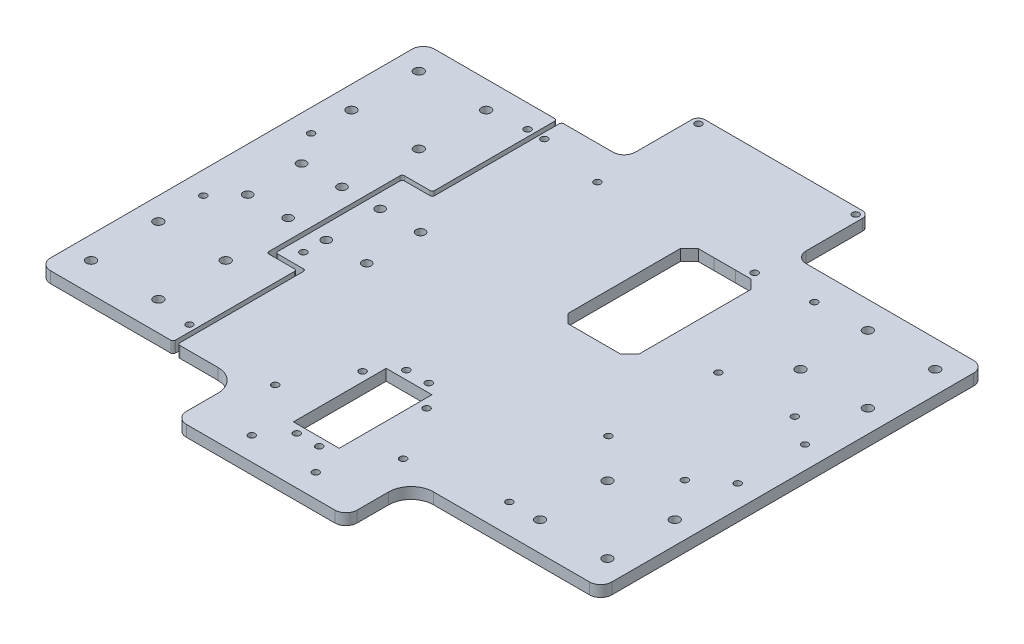
from build123d import *

# Parameters (mm, degrees)
SKETCH_1_W           = 250
SKETCH_1_H           = 200
EXTRUDE_1_DEPTH      = 5
SKETCH_2_W           = 62
SKETCH_2_H           = 29
SKETCH_2_W_2         = 60
CUT_EXTRUDE_1_DEPTH  = 161.15617378
SKETCH_12_R          = 2.1
CUT_EXTRUDE_11_DEPTH = 10
SKETCH_15_R          = 1.5
CUT_EXTRUDE_14_DEPTH = 15
SKETCH_16_W          = 24.445253359
SKETCH_16_H          = 29
SKETCH_16_W_2        = 27.468529174
CUT_EXTRUDE_15_DEPTH = 15
FILLET_1_R           = 10
SKETCH_20_W          = 76.086217467
SKETCH_20_H          = 5
EXTRUDE_3_DEPTH      = 33
FILLET_3_R           = 3
FILLET_4_R           = 5
SKETCH_25_W          = 20.382425605
SKETCH_25_H          = 41.31601021
CUT_EXTRUDE_19_DEPTH = 10
SKETCH_26_R          = 1.5
CUT_EXTRUDE_20_DEPTH = 10
CUT_EXTRUDE_22_DEPTH = 10
SKETCH_27_R          = 2
CUT_EXTRUDE_21_DEPTH = 10
FILLET_5_R           = 1
FILLET_6_R           = 1
SKETCH_29_R          = 1.5
CUT_EXTRUDE_23_DEPTH = 10
SKETCH_30_R          = 1.5
CUT_EXTRUDE_24_DEPTH = 10
SKETCH_32_R          = 1.5
CUT_EXTRUDE_27_DEPTH = 5
CUT_EXTRUDE_30_DEPTH = 5
SKETCH_39_R          = 1.5
CUT_EXTRUDE_31_DEPTH = 5


with BuildPart() as part:
    # 草图1 → 凸台-拉伸1 (new body)
    with BuildSketch(Plane(origin=(0, 0, 0), x_dir=(1, 0, 0), z_dir=(0, 1, 0))):
        Rectangle(SKETCH_1_W, SKETCH_1_H)
    extrude(amount=EXTRUDE_1_DEPTH)

    # 草图2 → 切除-拉伸1 (cut, through all)
    with BuildSketch(Plane(origin=(0, 5, 0), x_dir=(1, 0, 0), z_dir=(0, 1, 0))):
        with Locations((-94, -85.5)):
            Rectangle(SKETCH_2_W, SKETCH_2_H)
        with Locations((95, -85.5)):
            Rectangle(SKETCH_2_W_2, SKETCH_2_H)
    extrude(amount=-CUT_EXTRUDE_1_DEPTH, mode=Mode.SUBTRACT)

    # 草图12 → 切除-拉伸11 (cut)
    with BuildSketch(Plane(origin=(0, 5, 0), x_dir=(1, 0, 0), z_dir=(0, 1, 0))):
        with Locations(Location((85, -28, 0), (0, 0, 270))):
            Circle(SKETCH_12_R)
        with Locations(Location((115, -28, 0), (0, 0, 270))):
            Circle(SKETCH_12_R)
        with Locations(Location((115, -58, 0), (0, 0, 270))):
            Circle(SKETCH_12_R)
        with Locations(Location((85, -58, 0), (0, 0, 270))):
            Circle(SKETCH_12_R)
        with Locations(Location((-115, -28, 0), (0, 0, 270))):
            Circle(SKETCH_12_R)
        with Locations(Location((-85, -28, 0), (0, 0, 270))):
            Circle(SKETCH_12_R)
        with Locations(Location((-85, -58, 0), (0, 0, 270))):
            Circle(SKETCH_12_R)
        with Locations(Location((-115, -58, 0), (0, 0, 270))):
            Circle(SKETCH_12_R)
        with Locations(Location((-115, 88, 0), (0, 0, 270))):
            Circle(SKETCH_12_R)
        with Locations(Location((-85, 88, 0), (0, 0, 270))):
            Circle(SKETCH_12_R)
        with Locations(Location((-115, 58, 0), (0, 0, 270))):
            Circle(SKETCH_12_R)
        with Locations(Location((-85, 58, 0), (0, 0, 270))):
            Circle(SKETCH_12_R)
        with Locations(Location((115, 88, 0), (0, 0, 270))):
            Circle(SKETCH_12_R)
        with Locations(Location((85, 88, 0), (0, 0, 270))):
            Circle(SKETCH_12_R)
        with Locations(Location((115, 58, 0), (0, 0, 270))):
            Circle(SKETCH_12_R)
        with Locations(Location((85, 58, 0), (0, 0, 270))):
            Circle(SKETCH_12_R)
    extrude(amount=-CUT_EXTRUDE_11_DEPTH, mode=Mode.SUBTRACT)

    # 草图15 → 切除-拉伸14 (cut)
    with BuildSketch(Plane(origin=(0, 5, 0), x_dir=(1, 0, 0), z_dir=(0, 1, 0))):
        with Locations(Location((-115, 40, 0), (0, 0, 270))):
            Circle(SKETCH_15_R)
        with Locations(Location((-115, -8, 0), (0, 0, 270))):
            Circle(SKETCH_15_R)
        with Locations(Location((115, 0, 0), (0, 0, 270))):
            Circle(SKETCH_15_R)
        with Locations(Location((115, 30, 0), (0, 0, 270))):
            Circle(SKETCH_15_R)
        with Locations(Location((-68.353884334, -60.793566597, 0), (0, 0, 270))):
            Circle(SKETCH_15_R)
        with Locations(Location((-68.353884334, 89.793566597, 0), (0, 0, 270))):
            Circle(SKETCH_15_R)
        with Locations(Location((62.145255031, 87, 0), (0, 0, 270))):
            Circle(SKETCH_15_R)
        with Locations(Location((71.352890761, -58, 0), (0, 0, 270))):
            Circle(SKETCH_15_R)
    extrude(amount=-CUT_EXTRUDE_14_DEPTH, mode=Mode.SUBTRACT)

    # 草图16 → 切除-拉伸15 (cut)
    with BuildSketch(Plane(origin=(0, 5, 0), x_dir=(1, 0, 0), z_dir=(0, 1, 0))):
        with Locations((52.777373321, -85.5)):
            Rectangle(SKETCH_16_W, SKETCH_16_H)
        with Locations((-49.265735413, -85.5)):
            Rectangle(SKETCH_16_W_2, SKETCH_16_H)
    extrude(amount=-CUT_EXTRUDE_15_DEPTH, mode=Mode.SUBTRACT)

    # 圆角1
    fillet_1_edges = [part.edges().sort_by_distance(p)[0] for p in [
        (40.554746641, 2.5, 71),
        (-35.531470826, 2.5, 71),
    ]]
    fillet(fillet_1_edges, radius=FILLET_1_R)

    # 草图20 → 凸台-拉伸3 (add)
    with BuildSketch(Plane(origin=(0, 0, -100), x_dir=(-1, 0, 0), z_dir=(0, 0, -1))):
        with Locations((-2.511637907, 2.5)):
            Rectangle(SKETCH_20_W, SKETCH_20_H)
    extrude(amount=EXTRUDE_3_DEPTH)

    # 圆角3
    fillet_3_edges = [part.edges().sort_by_distance(p)[0] for p in [
        (40.554746641, 2.5, -133),
        (-35.531470826, 2.5, -133),
    ]]
    fillet(fillet_3_edges, radius=FILLET_3_R)

    # 圆角4
    fillet_4_edges = [part.edges().sort_by_distance(p)[0] for p in [
        (40.554746641, 2.5, 100),
        (-35.531470826, 2.5, 100),
        (40.554746641, 2.5, -100),
        (-35.531470826, 2.5, -100),
        (-125, 2.5, 71),
        (125, 2.5, 71),
        (-125, 2.5, -100),
        (125, 2.5, -100),
    ]]
    fillet(fillet_4_edges, radius=FILLET_4_R)

    # 草图25 → 切除-拉伸19 (cut)
    with BuildSketch(Plane(origin=(0, 5, 0), x_dir=(1, 0, 0), z_dir=(0, 1, 0))):
        with Locations((2.532364767, -54.544407129)):
            Rectangle(SKETCH_25_W, SKETCH_25_H)
    extrude(amount=-CUT_EXTRUDE_19_DEPTH, mode=Mode.SUBTRACT)

    # 草图26 → 切除-拉伸20 (cut)
    with BuildSketch(Plane(origin=(0, 5, 0), x_dir=(1, 0, 0), z_dir=(0, 1, 0))):
        with Locations(Location((-25.988362093, -65, 0), (0, 0, 270))):
            Circle(SKETCH_26_R)
        with Locations(Location((-11.738362093, -40.318275992, 0), (0, 0, 270))):
            Circle(SKETCH_26_R)
        with Locations(Location((16.761637907, -40.318275992, 0), (0, 0, 270))):
            Circle(SKETCH_26_R)
        with Locations(Location((31.011637907, -65, 0), (0, 0, 270))):
            Circle(SKETCH_26_R)
        with Locations(Location((16.761637907, -89.681724008, 0), (0, 0, 270))):
            Circle(SKETCH_26_R)
        with Locations(Location((-11.738362093, -89.681724008, 0), (0, 0, 270))):
            Circle(SKETCH_26_R)
        with Locations(Location((-2.488362093, -30.1, 0), (0, 0, 270))):
            Circle(SKETCH_26_R)
        with Locations(Location((7.511637907, -30.1, 0), (0, 0, 270))):
            Circle(SKETCH_26_R)
        with Locations(Location((-2.488362093, -78.9, 0), (0, 0, 270))):
            Circle(SKETCH_26_R)
        with Locations(Location((7.511637907, -78.9, 0), (0, 0, 270))):
            Circle(SKETCH_26_R)
    extrude(amount=-CUT_EXTRUDE_20_DEPTH, mode=Mode.SUBTRACT)

    # 草图28 → 切除-拉伸22 (cut)
    with BuildSketch(Plane(origin=(0, 5, 0), x_dir=(1, 0, 0), z_dir=(0, 1, 0))):
        Polygon((-63.454130163, 100), (-63.454130163, 42.465322203), (-76.855525146, 42.465322203), (-76.855525146, 26.266126934), (-76.855525146, 2.266126934), (-76.855525146, -13.933068336), (-63.454130163, -13.933068336), (-63.454130163, -71), (-65.454130163, -71), (-65.454130163, -15.933068336), (-78.855525146, -15.933068336), (-78.855525146, 2.266126934), (-78.855525146, 26.266126934), (-78.855525146, 44.465322203), (-65.454130163, 44.465322203), (-65.454130163, 100), align=None)
    extrude(amount=-CUT_EXTRUDE_22_DEPTH, mode=Mode.SUBTRACT)


with BuildPart() as cut_extrude_22_piece_1:
    # of the separate pieces the step leaves, piece 1, a body of its own (cut_extrude_22_pieces)
    add(part.part.solids().sort_by_distance((-35.531470826, 5, -105))[0])


with BuildPart() as cut_extrude_22_piece_2:
    # of the separate pieces the step leaves, piece 2, a body of its own (cut_extrude_22_pieces)
    add(part.part.solids().sort_by_distance((-120, 5, -100))[0])


with BuildPart() as cut_extrude_21_tool:
    # 草图27 → 切除-拉伸21 (new body)
    with BuildSketch(Plane(origin=(0, 5, 0), x_dir=(1, 0, 0), z_dir=(0, 1, 0))):
        with Locations(Location((-70.499273913, 2.266126934, 0), (0, 0, 270))):
            Circle(SKETCH_27_R)
        with Locations(Location((-70.499273913, 26.266126934, 0), (0, 0, 270))):
            Circle(SKETCH_27_R)
        with Locations(Location((-52.499273913, 2.266126934, 0), (0, 0, 270))):
            Circle(SKETCH_27_R)
        with Locations(Location((-52.499273913, 26.266126934, 0), (0, 0, 270))):
            Circle(SKETCH_27_R)
        with Locations(Location((-105.499273913, 2.266126934, 0), (0, 0, 270))):
            Circle(SKETCH_27_R)
        with Locations(Location((-87.499273913, 2.266126934, 0), (0, 0, 270))):
            Circle(SKETCH_27_R)
        with Locations(Location((-105.499273913, 26.266126934, 0), (0, 0, 270))):
            Circle(SKETCH_27_R)
        with Locations(Location((-87.499273913, 26.266126934, 0), (0, 0, 270))):
            Circle(SKETCH_27_R)
    extrude(amount=-CUT_EXTRUDE_21_DEPTH)


with BuildPart() as cut_extrude_22_piece_1_1:
    add(cut_extrude_22_piece_1.part)

    # 切除-拉伸21: cut by cut_extrude_21_tool
    add(cut_extrude_21_tool.part, mode=Mode.SUBTRACT)

    # 圆角6
    fillet_6_edges = [cut_extrude_22_piece_1_1.edges().sort_by_distance(p)[0] for p in [
        (-63.454130163, 2.5, -100),
        (-63.454130163, 2.5, -42.465322203),
        (-76.855525146, 2.5, -42.465322203),
        (-76.855525146, 2.5, 13.933068336),
        (-63.454130163, 2.5, 13.933068336),
        (-63.454130163, 2.5, 71),
    ]]
    fillet(fillet_6_edges, radius=FILLET_6_R)

    # 草图29 → 切除-拉伸23 (cut)
    with BuildSketch(Plane(origin=(0, 5, 0), x_dir=(1, 0, 0), z_dir=(0, 1, 0))):
        with Locations(Location((-60.864682609, 89.793566597, 0), (0, 0, 270))):
            Circle(SKETCH_29_R)
    extrude(amount=-CUT_EXTRUDE_23_DEPTH, mode=Mode.SUBTRACT)

    # 草图30 → 切除-拉伸24 (cut)
    with BuildSketch(Plane(origin=(0, 5, 0), x_dir=(1, 0, 0), z_dir=(0, 1, 0))):
        with Locations(Location((-70.874244833, -7.534328491, 0), (0, 0, 270))):
            Circle(SKETCH_30_R)
    extrude(amount=-CUT_EXTRUDE_24_DEPTH, mode=Mode.SUBTRACT)

    # 草图32 → 切除-拉伸27 (cut)
    with BuildSketch(Plane(origin=(0, 5, 0), x_dir=(1, 0, 0), z_dir=(0, 1, 0))):
        with Locations(Location((67.964081229, 38.5, 0), (0, 0, 270))):
            Circle(SKETCH_32_R)
        with Locations(Location((67.964081229, -10.5, 0), (0, 0, 270))):
            Circle(SKETCH_32_R)
        with Locations(Location((101.964081229, 38.5, 0), (0, 0, 270))):
            Circle(SKETCH_32_R)
        with Locations(Location((101.964081229, -10.5, 0), (0, 0, 270))):
            Circle(SKETCH_32_R)
    extrude(amount=-CUT_EXTRUDE_27_DEPTH, mode=Mode.SUBTRACT)

    # 草图36 → 切除-拉伸30 (cut)
    with BuildSketch(Plane(origin=(0, 5, 0), x_dir=(1, 0, 0), z_dir=(0, 1, 0))):
        Polygon((15.652967236, 81.806945115), (11.652967906, 77.806951551), (11.652963832, 54.735880974), (11.652961938, 27.806946201), (15.652959177, 23.806943096), (22.652957242, 23.806944978), (32.15295282, 23.806942501), (39.152952649, 23.806936909), (43.152955853, 27.806941598), (43.152959585, 54.735874484), (43.152965472, 77.806941311), (39.152968134, 81.806936966), (32.152968305, 81.806942558), (22.652972653, 81.806939448), align=None)
    extrude(amount=-CUT_EXTRUDE_30_DEPTH, mode=Mode.SUBTRACT)

    # 草图39 → 切除-拉伸31 (cut)
    with BuildSketch(Plane.XZ):
        with Locations(Location((-32.445253359, -130, 0), (0, 0, 270))):
            Circle(SKETCH_39_R)
        with Locations(Location((-32.445253359, -85, 0), (0, 0, 270))):
            Circle(SKETCH_39_R)
        with Locations(Location((37.554746641, -130, 0), (0, 0, 270))):
            Circle(SKETCH_39_R)
        with Locations(Location((37.554746641, -85, 0), (0, 0, 270))):
            Circle(SKETCH_39_R)
    extrude(amount=-CUT_EXTRUDE_31_DEPTH, mode=Mode.SUBTRACT)


with BuildPart() as cut_extrude_22_piece_2_1:
    add(cut_extrude_22_piece_2.part)

    # 切除-拉伸21: cut by cut_extrude_21_tool
    add(cut_extrude_21_tool.part, mode=Mode.SUBTRACT)

    # 圆角5
    fillet_5_edges = [cut_extrude_22_piece_2_1.edges().sort_by_distance(p)[0] for p in [
        (-65.454130163, 2.5, 71),
        (-65.454130163, 2.5, -100),
        (-65.454130163, 2.5, 15.933068336),
        (-78.855525146, 2.5, 15.933068336),
        (-78.855525146, 2.5, -44.465322203),
        (-65.454130163, 2.5, -44.465322203),
    ]]
    fillet(fillet_5_edges, radius=FILLET_5_R)


solid = Compound([cut_extrude_22_piece_1_1.part, cut_extrude_22_piece_2_1.part])
